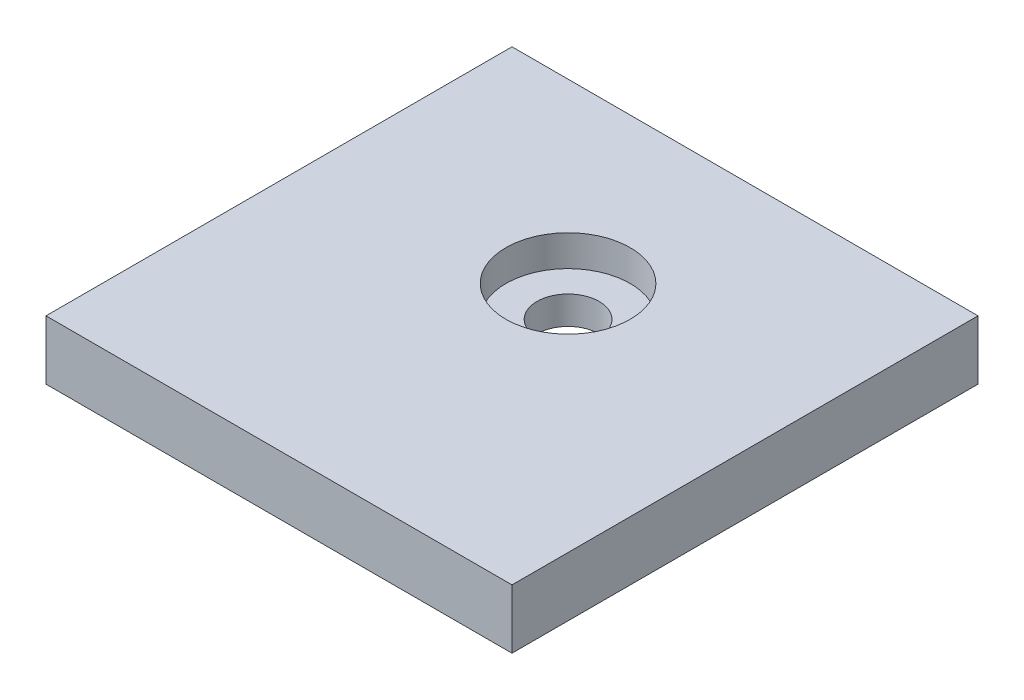
from build123d import *

# Parameters (mm, degrees)
CROQUIS1_W              = 75
CROQUIS1_H              = 75
CROQUIS1_R              = 5
SALIENTE_EXTRUIR1_DEPTH = 9.525
CROQUIS2_R              = 10
CORTAR_EXTRUIR1_DEPTH   = 5


with BuildPart() as part:
    # Croquis1 → Saliente-Extruir1 (new body)
    with BuildSketch(Plane(origin=(0, 0, 0), x_dir=(1, 0, 0), z_dir=(0, 1, 0))):
        Rectangle(CROQUIS1_W, CROQUIS1_H)
        with Locations(Location((0, 9.022258823, 0), (0, 0, 90))):
            Circle(CROQUIS1_R, mode=Mode.SUBTRACT)
    extrude(amount=SALIENTE_EXTRUIR1_DEPTH)

    # Croquis2 → Cortar-Extruir1 (cut)
    with BuildSketch(Plane(origin=(0, 9.525, 0), x_dir=(1, 0, 0), z_dir=(0, 1, 0))):
        with Locations(Location((0, 9.022258823, 0), (0, 0, 270))):
            Circle(CROQUIS2_R)
    extrude(amount=-CORTAR_EXTRUIR1_DEPTH, mode=Mode.SUBTRACT)


solid = part.part
